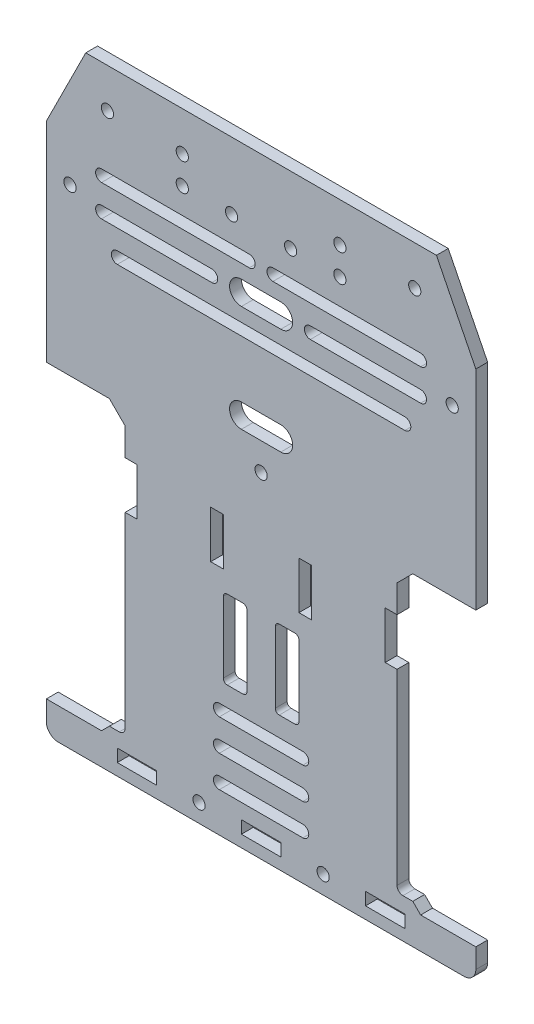
from build123d import *

# Parameters (mm, degrees)
ESBO_O1_R                = 1.55
ESBO_O1_W                = 3.2
ESBO_O1_H                = 12
ESBO_O1_W_2              = 10
ESBO_O1_H_2              = 3.2
RESSALTO_EXTRUS_O1_DEPTH = 3
ESBO_O2_R                = 1.55
CORTE_EXTRUS_O1_DEPTH    = 10
ESBO_O3_R                = 1.55
CORTE_EXTRUS_O2_DEPTH    = 190.512532567
CORTE_EXTRUS_O5_DEPTH    = 10


with BuildPart() as part:
    # Esboço1 → Ressalto-extrusão1 (new body)
    with BuildSketch(Plane.XY):
        with BuildLine():
            Line((0, 82), (16, 82))
            Line((16, 82), (20, 78))
            Line((20, 78), (20, 71))
            Line((20, 71), (23, 71))
            Line((23, 71), (23, 59))
            Line((23, 59), (20, 59))
            Line((20, 59), (20, 11.5))
            ThreePointArc((20, 11.5), (19.560660172, 10.439339828), (18.5, 10))
            Line((18.5, 10), (16, 10))
            Line((16, 10), (14, 8))
            Line((14, 8), (0, 8))
            Line((0, 8), (0, 3))
            ThreePointArc((0, 3), (0.878679656, 0.878679656), (3, 0))
            Line((3, 0), (106, 0))
            ThreePointArc((106, 0), (108.121320344, 0.878679656), (109, 3))
            Line((109, 3), (109, 8))
            Line((109, 8), (95, 8))
            Line((95, 8), (93, 10))
            Line((93, 10), (90.5, 10))
            ThreePointArc((90.5, 10), (89.439339828, 10.439339828), (89, 11.5))
            Line((89, 11.5), (89, 59))
            Line((89, 59), (86, 59))
            Line((86, 59), (86, 71))
            Line((86, 71), (89, 71))
            Line((89, 71), (89, 78))
            Line((89, 78), (93, 82))
            Line((93, 82), (109, 82))
            Line((109, 82), (109, 135))
            Line((109, 135), (99, 155))
            Line((99, 155), (10, 155))
            Line((10, 155), (0, 135))
            Line((0, 135), (0, 82))
        make_face()
        with Locations((47, 138)):
            Circle(ESBO_O1_R, mode=Mode.SUBTRACT)
        with Locations((62, 138)):
            Circle(ESBO_O1_R, mode=Mode.SUBTRACT)
        with Locations((74.5, 138)):
            Circle(ESBO_O1_R, mode=Mode.SUBTRACT)
        with Locations((34.5, 138)):
            Circle(ESBO_O1_R, mode=Mode.SUBTRACT)
        with Locations((74.5, 145)):
            Circle(ESBO_O1_R, mode=Mode.SUBTRACT)
        with Locations((93.5, 145)):
            Circle(ESBO_O1_R, mode=Mode.SUBTRACT)
        with Locations((15.5, 145)):
            Circle(ESBO_O1_R, mode=Mode.SUBTRACT)
        with Locations((34.5, 145)):
            Circle(ESBO_O1_R, mode=Mode.SUBTRACT)
        with BuildLine():
            Line((59.1, 54), (63.1, 54))
            ThreePointArc((63.1, 54), (63.807106781, 53.707106781), (64.1, 53))
            Line((64.1, 53), (64.1, 35))
            ThreePointArc((64.1, 35), (63.807106781, 34.292893219), (63.1, 34))
            Line((63.1, 34), (59.1, 34))
            ThreePointArc((59.1, 34), (58.392893219, 34.292893219), (58.1, 35))
            Line((58.1, 35), (58.1, 53))
            ThreePointArc((58.1, 53), (58.392893219, 53.707106781), (59.1, 54))
        make_face(mode=Mode.SUBTRACT)
        with Locations((43.3, 65)):
            Rectangle(ESBO_O1_W, ESBO_O1_H, mode=Mode.SUBTRACT)
        with Locations((65.7, 65)):
            Rectangle(ESBO_O1_W, ESBO_O1_H, mode=Mode.SUBTRACT)
        with BuildLine():
            Line((45.9, 54), (49.9, 54))
            ThreePointArc((49.9, 54), (50.607106781, 53.707106781), (50.9, 53))
            Line((50.9, 53), (50.9, 35))
            ThreePointArc((50.9, 35), (50.607106781, 34.292893219), (49.9, 34))
            Line((49.9, 34), (45.9, 34))
            ThreePointArc((45.9, 34), (45.192893219, 34.292893219), (44.9, 35))
            Line((44.9, 35), (44.9, 53))
            ThreePointArc((44.9, 53), (45.192893219, 53.707106781), (45.9, 54))
        make_face(mode=Mode.SUBTRACT)
        with Locations((86, 4.6)):
            Rectangle(ESBO_O1_W_2, ESBO_O1_H_2, mode=Mode.SUBTRACT)
        with Locations((54.5, 4.6)):
            Rectangle(ESBO_O1_W_2, ESBO_O1_H_2, mode=Mode.SUBTRACT)
        with Locations((23, 4.6)):
            Rectangle(ESBO_O1_W_2, ESBO_O1_H_2, mode=Mode.SUBTRACT)
    extrude(amount=RESSALTO_EXTRUS_O1_DEPTH)

    # Esboço2 → Corte-extrusão1 (cut)
    with BuildSketch(Plane(origin=(0, 0, 0), x_dir=(-1, 0, 0), z_dir=(0, 0, -1))):
        with Locations((-54.5, 85)):
            Circle(ESBO_O2_R)
        with Locations((-70.25, 4.6)):
            Circle(ESBO_O2_R)
        with Locations((-38.75, 4.6)):
            Circle(ESBO_O2_R)
    extrude(amount=-CORTE_EXTRUS_O1_DEPTH, mode=Mode.SUBTRACT)

    # Esboço3 → Corte-extrusão2 (cut, through all)
    with BuildSketch(Plane.XY.offset(3)):
        with Locations((6, 124)):
            Circle(ESBO_O3_R)
        with Locations((103, 124)):
            Circle(ESBO_O3_R)
    extrude(amount=-CORTE_EXTRUS_O2_DEPTH, mode=Mode.SUBTRACT)

    # Esboço5 → Corte-extrusão5 (cut)
    with BuildSketch(Plane(origin=(0, 0, 0), x_dir=(-1, 0, 0), z_dir=(0, 0, -1))):
        with BuildLine():
            Line((-95, 131.5), (-57.5, 131.5))
            ThreePointArc((-57.5, 131.5), (-56, 130), (-57.5, 128.5))
            Line((-57.5, 128.5), (-95, 128.5))
            ThreePointArc((-95, 128.5), (-96.5, 130), (-95, 131.5))
        make_face()
        with BuildLine():
            Line((-51.5, 131.5), (-14, 131.5))
            ThreePointArc((-14, 131.5), (-12.5, 130), (-14, 128.5))
            Line((-14, 128.5), (-51.5, 128.5))
            ThreePointArc((-51.5, 128.5), (-53, 130), (-51.5, 131.5))
        make_face()
        with BuildLine():
            Line((-59.5, 125), (-49.5, 125))
            ThreePointArc((-49.5, 125), (-46.5, 122), (-49.5, 119))
            Line((-49.5, 119), (-59.5, 119))
            ThreePointArc((-59.5, 119), (-62.5, 122), (-59.5, 125))
        make_face()
        with BuildLine():
            Line((-95, 123.5), (-67, 123.5))
            ThreePointArc((-67, 123.5), (-65.5, 122), (-67, 120.5))
            Line((-67, 120.5), (-95, 120.5))
            ThreePointArc((-95, 120.5), (-96.5, 122), (-95, 123.5))
        make_face()
        with BuildLine():
            Line((-42, 123.5), (-14, 123.5))
            ThreePointArc((-14, 123.5), (-12.5, 122), (-14, 120.5))
            Line((-14, 120.5), (-42, 120.5))
            ThreePointArc((-42, 120.5), (-43.5, 122), (-42, 123.5))
        make_face()
        with BuildLine():
            Line((-91, 115.5), (-18, 115.5))
            ThreePointArc((-18, 115.5), (-16.5, 114), (-18, 112.5))
            Line((-18, 112.5), (-91, 112.5))
            ThreePointArc((-91, 112.5), (-92.5, 114), (-91, 115.5))
        make_face()
        with BuildLine():
            Line((-59.5, 98), (-49.5, 98))
            ThreePointArc((-49.5, 98), (-46.5, 95), (-49.5, 92))
            Line((-49.5, 92), (-59.5, 92))
            ThreePointArc((-59.5, 92), (-62.5, 95), (-59.5, 98))
        make_face()
        with BuildLine():
            Line((-65.1, 13), (-43.9, 13))
            ThreePointArc((-43.9, 13), (-42.4, 11.5), (-43.9, 10))
            Line((-43.9, 10), (-65.1, 10))
            ThreePointArc((-65.1, 10), (-66.6, 11.5), (-65.1, 13))
        make_face()
        with BuildLine():
            Line((-65.1, 21), (-43.9, 21))
            ThreePointArc((-43.9, 21), (-42.4, 19.5), (-43.9, 18))
            Line((-43.9, 18), (-65.1, 18))
            ThreePointArc((-65.1, 18), (-66.6, 19.5), (-65.1, 21))
        make_face()
        with BuildLine():
            Line((-65.1, 29), (-43.9, 29))
            ThreePointArc((-43.9, 29), (-42.4, 27.5), (-43.9, 26))
            Line((-43.9, 26), (-65.1, 26))
            ThreePointArc((-65.1, 26), (-66.6, 27.5), (-65.1, 29))
        make_face()
    extrude(amount=-CORTE_EXTRUS_O5_DEPTH, mode=Mode.SUBTRACT)


solid = part.part
